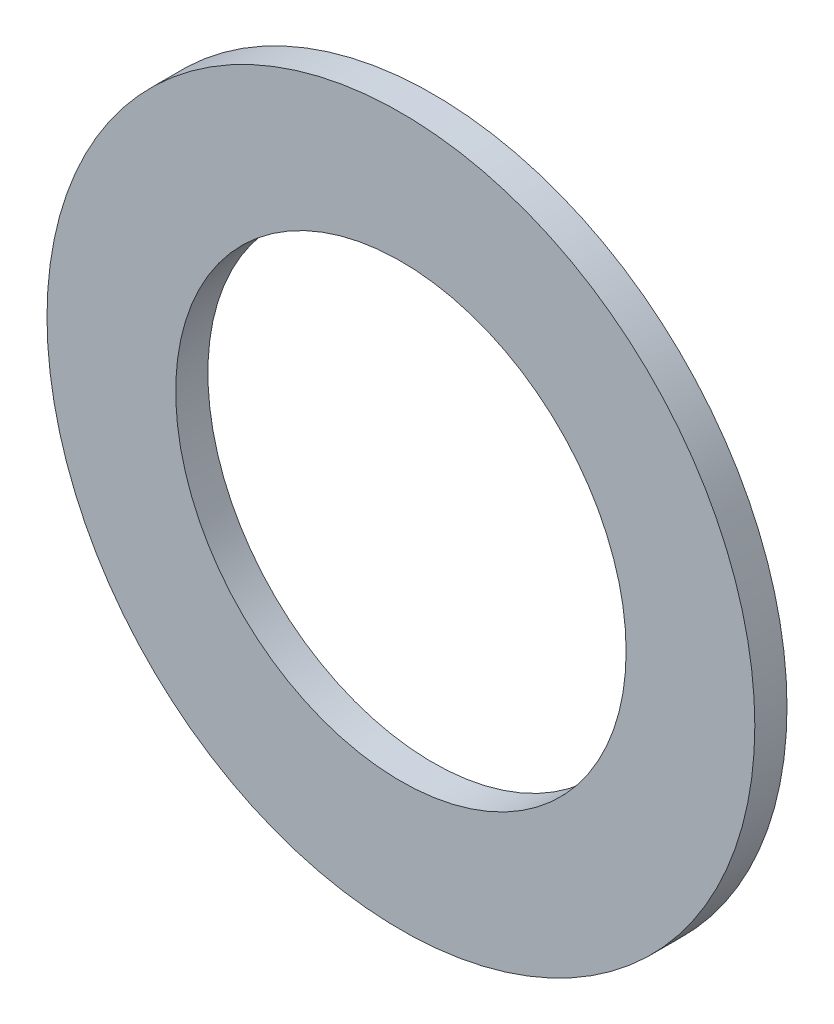
from build123d import *

# Parameters (mm, degrees)
ESQUISSE1_R        = 5.5
ESQUISSE1_R_2      = 3.5
BOSS_EXTRU_1_DEPTH = 0.5


with BuildPart() as part:
    # Esquisse1 → Boss.-Extru.1 (new body)
    with BuildSketch(Plane.XY):
        Circle(ESQUISSE1_R)
        Circle(ESQUISSE1_R_2, mode=Mode.SUBTRACT)
    extrude(amount=BOSS_EXTRU_1_DEPTH)


solid = part.part
